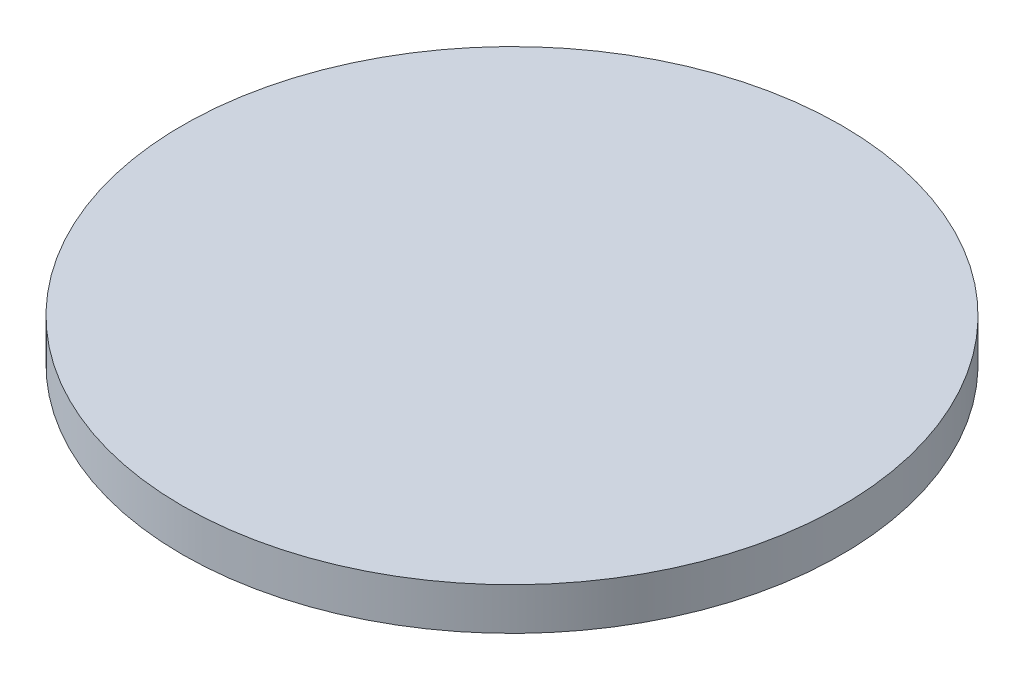
from build123d import *

# Parameters (mm, degrees)
SKETCH2_R           = 62.5
SKETCH2_R_2         = 11.25
SKETCH2_R_3         = 25.25
BOSS_EXTRUDE1_DEPTH = 5
BOSS_EXTRUDE2_START = 3
SKETCH1_R           = 62.5
BOSS_EXTRUDE2_DEPTH = 3


with BuildPart() as part:
    # Sketch2 → Boss-Extrude1 (new body)
    with BuildSketch(Plane(origin=(0, 0, 0), x_dir=(1, 0, 0), z_dir=(0, 1, 0))):
        with Locations(Location((0, 0, 0), (0, 0, 270))):
            Circle(SKETCH2_R)
        with Locations(Location((0, 37.5, 0), (0, 0, 270))):
            Circle(SKETCH2_R_2, mode=Mode.SUBTRACT)
        with Locations(Location((22.041946961, 30.338137289, 0), (0, 0, 270))):
            Circle(SKETCH2_R_2, mode=Mode.SUBTRACT)
        with Locations(Location((35.664619361, 11.588137289, 0), (0, 0, 270))):
            Circle(SKETCH2_R_2, mode=Mode.SUBTRACT)
        with Locations(Location((35.664619361, -11.588137289, 0), (0, 0, 270))):
            Circle(SKETCH2_R_2, mode=Mode.SUBTRACT)
        with Locations(Location((22.041946961, -30.338137289, 0), (0, 0, 270))):
            Circle(SKETCH2_R_2, mode=Mode.SUBTRACT)
        with Locations(Location((0, -37.5, 0), (0, 0, 270))):
            Circle(SKETCH2_R_2, mode=Mode.SUBTRACT)
        with Locations(Location((-22.041946961, -30.338137289, 0), (0, 0, 270))):
            Circle(SKETCH2_R_2, mode=Mode.SUBTRACT)
        with Locations(Location((-35.664619361, -11.588137289, 0), (0, 0, 270))):
            Circle(SKETCH2_R_2, mode=Mode.SUBTRACT)
        with Locations(Location((-35.664619361, 11.588137289, 0), (0, 0, 270))):
            Circle(SKETCH2_R_2, mode=Mode.SUBTRACT)
        with Locations(Location((-22.041946961, 30.338137289, 0), (0, 0, 270))):
            Circle(SKETCH2_R_2, mode=Mode.SUBTRACT)
        with Locations(Location((0, 0, 0), (0, 0, 270))):
            Circle(SKETCH2_R_3, mode=Mode.SUBTRACT)
    extrude(amount=-BOSS_EXTRUDE1_DEPTH)

    # Sketch1 → Boss-Extrude2 (add)
    with BuildSketch(Plane(origin=(0, 0, 0), x_dir=(1, 0, 0), z_dir=(0, 1, 0)).offset(BOSS_EXTRUDE2_START)):
        with Locations(Location((0, 0, 0), (0, 0, 270))):
            Circle(SKETCH1_R)
    extrude(amount=-BOSS_EXTRUDE2_DEPTH)


solid = part.part
